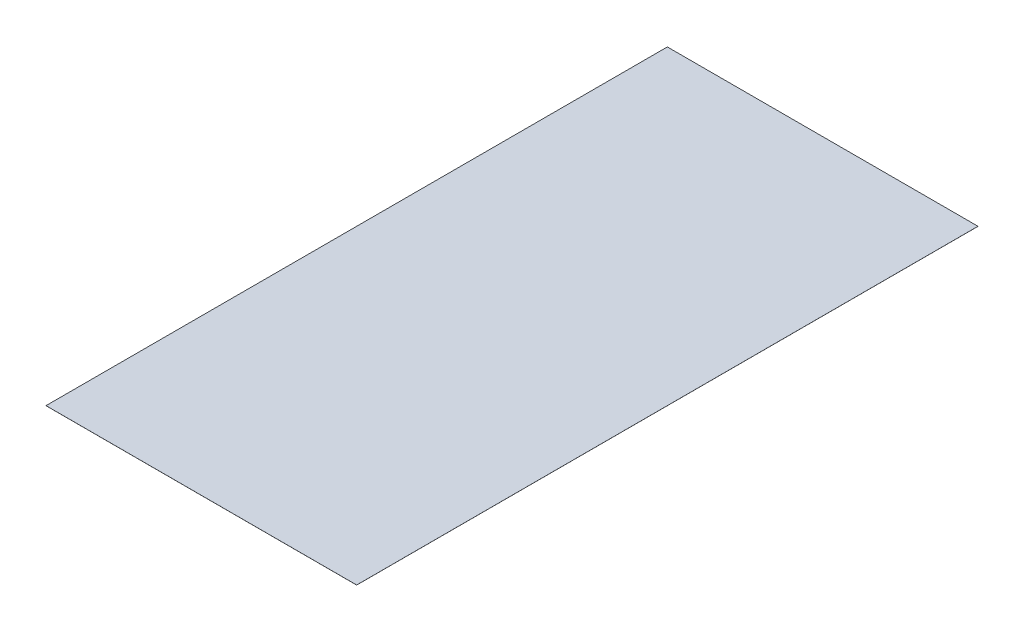
from build123d import *

# Parameters (mm, degrees)
SKETCH1_W           = 5000
SKETCH1_H           = 10000
BOSS_EXTRUDE1_DEPTH = 1


with BuildPart() as part:
    # Sketch1 → Boss-Extrude1 (new body)
    with BuildSketch(Plane(origin=(0, 0, 0), x_dir=(1, 0, 0), z_dir=(0, 1, 0))):
        Rectangle(SKETCH1_W, SKETCH1_H)
    extrude(amount=BOSS_EXTRUDE1_DEPTH)


solid = part.part
